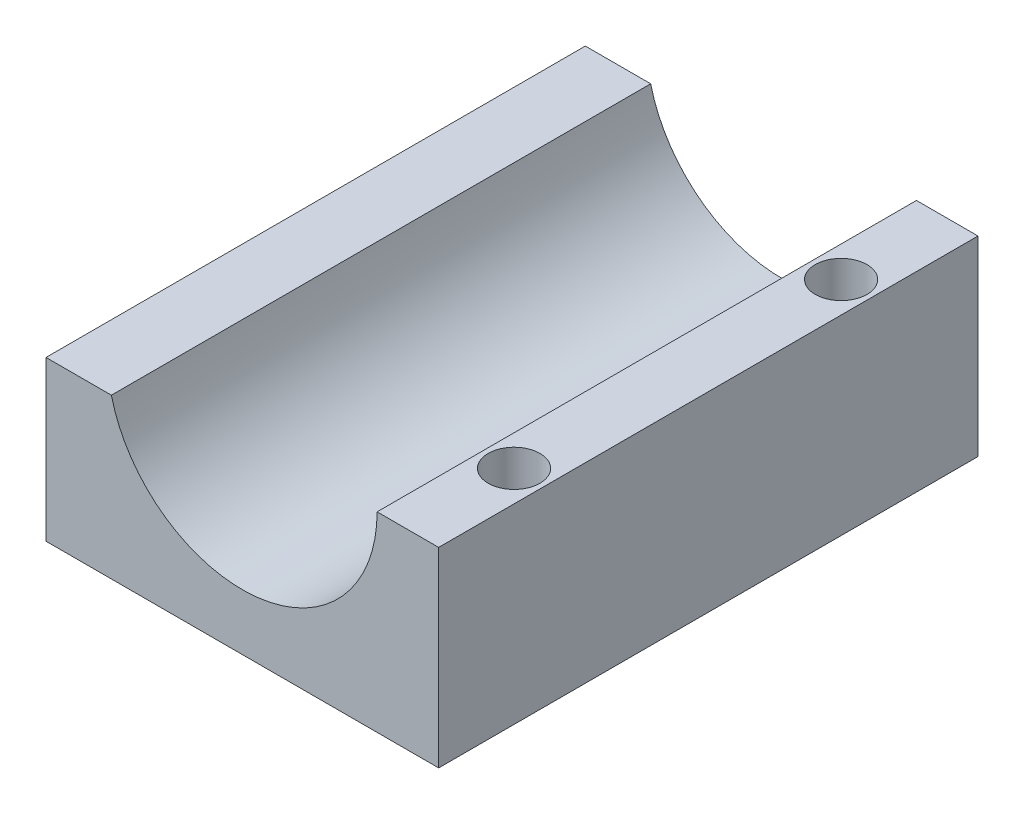
from build123d import *

# Parameters (mm, degrees)
SKETCH2_W               = 18.5
SKETCH2_H               = 25.41
BOSS_EXTRUDE1_DEPTH     = 9
CUT_EXTRUDE1_DEPTH      = 25.41
CUT_EXTRUDE3_DEPTH      = 33.694312961
CUT_EXTRUDE3_DEPTH_BACK = 25.41
SKETCH10_R              = 1.22
CUT_EXTRUDE4_DEPTH      = 33.694312961


with BuildPart() as part:
    # Sketch2 → Boss-Extrude1 (new body)
    with BuildSketch(Plane(origin=(0, 0, 0), x_dir=(1, 0, 0), z_dir=(0, 1, 0))):
        with Locations((9.25, 12.705)):
            Rectangle(SKETCH2_W, SKETCH2_H)
    extrude(amount=BOSS_EXTRUDE1_DEPTH)

    # Sketch6 → Cut-Extrude1 (cut)
    with BuildSketch(Plane.XY):
        with BuildLine():
            Line((2.9, 9), (15.6, 9))
            ThreePointArc((15.6, 9), (9.25, 2.65), (2.9, 9))
        make_face()
    extrude(amount=-CUT_EXTRUDE1_DEPTH, mode=Mode.SUBTRACT)

    # Sketch14 → Cut-Extrude3 (cut, two sides: drawn at the far end of the back side and taken through both)
    with BuildSketch(Plane(origin=(0, 0, -25.41), x_dir=(-1, 0, 0), z_dir=(0, 0, -1)).offset(-CUT_EXTRUDE3_DEPTH_BACK)):
        Polygon((0, 60.146081223), (0, 9), (0, 7.5), (-3.246658661, 7.5), (-2.9, 9), (8.616604878, 58.832614185), (24.031387378, 159.956651774), (15.4147825, 161.270118812), align=None)
    extrude(amount=CUT_EXTRUDE3_DEPTH + CUT_EXTRUDE3_DEPTH_BACK, mode=Mode.SUBTRACT)


with BuildPart() as cut_extrude3_kept_piece:
    # of the separate pieces the step leaves, the one the design keeps (cut_extrude3_pieces_kept)
    add(part.part.solids().sort_by_distance((0, 0, 0))[0])

    # Sketch10 → Cut-Extrude4 (cut, through all)
    with BuildSketch(Plane(origin=(0, 9, 0), x_dir=(1, 0, 0), z_dir=(0, 1, 0))):
        with Locations(Location((17.05, 20.41, 0), (0, 0, 270))):
            Circle(SKETCH10_R)
        with Locations(Location((17.05, 5, 0), (0, 0, 270))):
            Circle(SKETCH10_R)
    extrude(amount=-CUT_EXTRUDE4_DEPTH, mode=Mode.SUBTRACT)


solid = cut_extrude3_kept_piece.part
